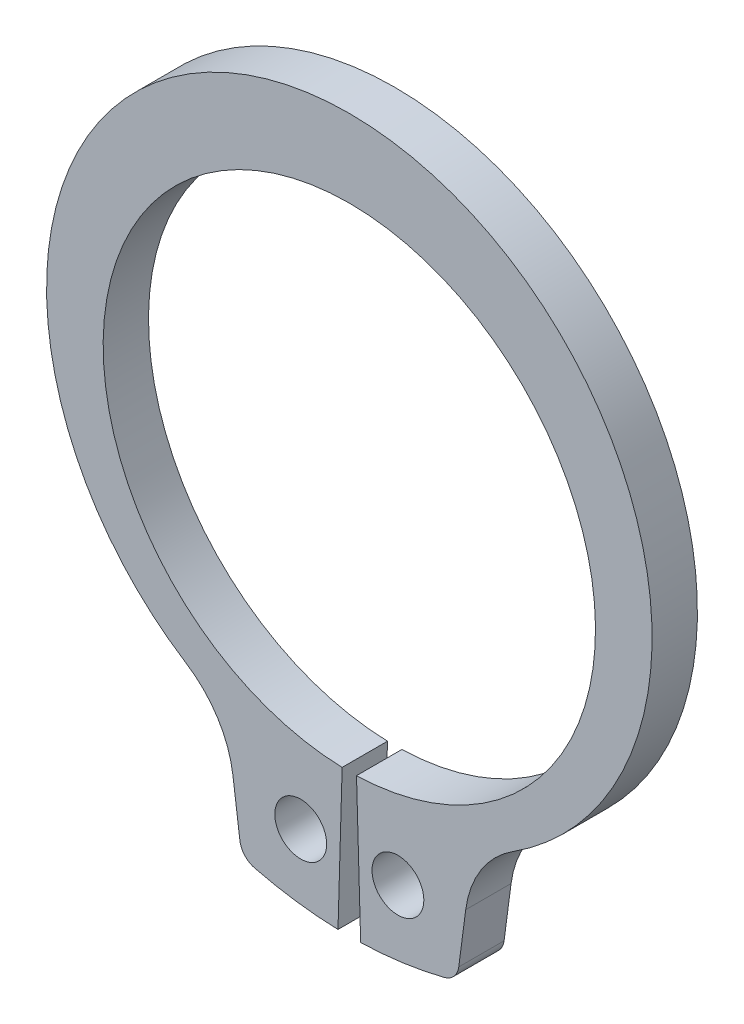
from build123d import *

# Parameters (mm, degrees)
BODYSKE_R  = 1
BODY_DEPTH = 1.75


with BuildPart() as part:
    # BodySke → Body (new body)
    with BuildSketch(Plane.XY):
        with BuildLine():
            Line((0.277083333, -9.495958342), (0.4375, -14.993618434))
            ThreePointArc((0.4375, -14.993618434), (2.061766267, -14.857628339), (3.6616878, -14.546203713))
            ThreePointArc((3.6616878, -14.546203713), (4.038710001, -14.317672643), (4.222187056, -13.916788171))
            Line((4.222187056, -13.916788171), (4.491921103, -11.867954674))
            ThreePointArc((4.491921103, -11.867954674), (5.081363333, -10.245619428), (6.299824924, -9.023013545))
            ThreePointArc((6.299824924, -9.023013545), (0, 12.5), (-6.299824924, -9.023013545))
            ThreePointArc((-6.299824924, -9.023013545), (-5.081363333, -10.245619428), (-4.491921103, -11.867954674))
            Line((-4.491921103, -11.867954674), (-4.222187056, -13.916788171))
            ThreePointArc((-4.222187056, -13.916788171), (-4.038710001, -14.317672643), (-3.6616878, -14.546203713))
            ThreePointArc((-3.6616878, -14.546203713), (-2.061766267, -14.857628339), (-0.4375, -14.993618434))
            Line((-0.4375, -14.993618434), (-0.277083333, -9.495958342))
            ThreePointArc((-0.277083333, -9.495958342), (0, 9.5), (0.277083333, -9.495958342))
        make_face()
        with Locations((1.875, -12.358574958)):
            Circle(BODYSKE_R, mode=Mode.SUBTRACT)
        with Locations((-1.875, -12.358574958)):
            Circle(BODYSKE_R, mode=Mode.SUBTRACT)
    extrude(amount=-BODY_DEPTH)


solid = part.part
